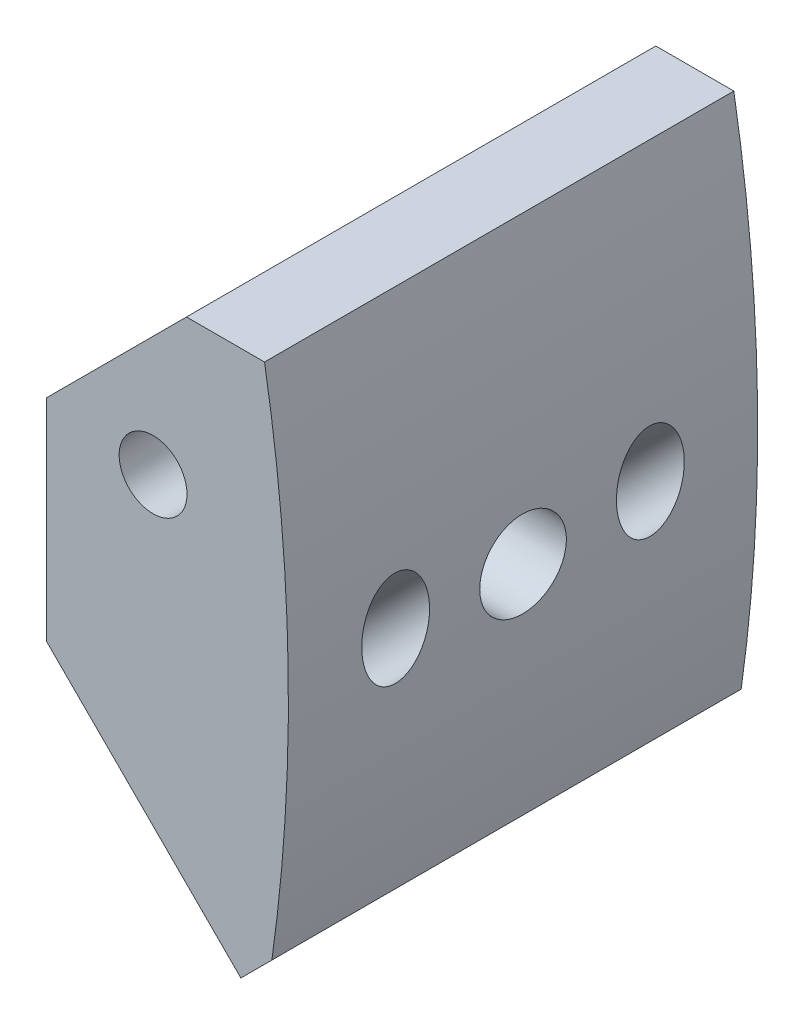
from build123d import *

# Parameters (mm, degrees)
EXTRUDE1_DEPTH            = 18.7198
SKETCH13_W                = 30.336118919
SKETCH13_H                = 26.43936277
EXTRUDE2_DEPTH            = 40.057833358
F_6_32_TAPPED_HOLE2_D     = 2.7051
EXTRUDE3_DEPTH            = 40.057833358
F_6_32_TAPPED_HOLE1_D     = 2.7051
F_8_32_TAPPED_HOLE5_D     = 3.4544
F_8_32_TAPPED_HOLE5_DEPTH = 19.05
F_8_32_TAPPED_HOLE5_TIP   = 1.037806461
SKETCH22_W                = 9.398
SKETCH22_H                = 21.690053411
EXTRUDE4_DEPTH            = 33.232321948
CHAMFER1_SIZE             = 5.588
CUT_EXTRUDE1_DEPTH        = 33.232321948


with BuildPart() as part:
    # Sketch1 → Extrude1 (new body)
    with BuildSketch(Plane.XY):
        with BuildLine():
            Line((0, 0), (0, -13.17458008))
            Line((0, -13.17458008), (15.324208221, -28.498788301))
            ThreePointArc((15.324208221, -28.498788301), (19.05, -6.58729004), (15.324208221, 15.324208221))
            Line((15.324208221, 15.324208221), (0, 15.324208221))
            Line((0, 15.324208221), (0, 0))
        make_face()
    extrude(amount=EXTRUDE1_DEPTH)

    # Sketch13 → Extrude2 (cut, through all)
    with BuildSketch(Plane.XY.offset(18.7198)):
        with Locations((15.16805946, 17.825101305)):
            Rectangle(SKETCH13_W, SKETCH13_H)
    extrude(amount=-EXTRUDE2_DEPTH, mode=Mode.SUBTRACT)

    # #6-32 Tapped Hole2 (through all)
    with Locations(Plane.XY.offset(18.7198)):
        with Locations((13.6525, -1.50729004)):
            Hole(F_6_32_TAPPED_HOLE2_D / 2)

    # Sketch14 → Extrude3 (cut, through all)
    with BuildSketch(Plane.XY.offset(18.7198)):
        Polygon((0.684709755, -13.859289835), (7.276217748, -7.267781842), (18.052525094, -18.044089188), (21.915716214, -21.907280308), (15.324208221, -28.498788301), align=None)
    extrude(amount=-EXTRUDE3_DEPTH, mode=Mode.SUBTRACT)

    # #6-32 Tapped Hole1 (through all)
    with Locations(Plane(origin=(12.651735758, -12.643299852, 14.4399), x_dir=(-0.707106781187, 0.707106781187, 0), z_dir=(-0.707106781187, -0.707106781187, 0))):
        with Locations((0, 0), (0, 10.16)):
            Hole(F_6_32_TAPPED_HOLE1_D / 2)

    # #8-32 Tapped Hole5
    with Locations(Plane.ZY):
        with Locations((9.3599, -6.58729004)):
            Hole(F_8_32_TAPPED_HOLE5_D / 2, depth=F_8_32_TAPPED_HOLE5_DEPTH)
            with Locations((0, 0, -(F_8_32_TAPPED_HOLE5_DEPTH + F_8_32_TAPPED_HOLE5_TIP / 2))):  # 118° drill point
                Cone(0, F_8_32_TAPPED_HOLE5_D / 2, F_8_32_TAPPED_HOLE5_TIP, mode=Mode.SUBTRACT)

    # Sketch22 → Extrude4 (cut, through all)
    with BuildSketch(Plane.XY.offset(18.7198)):
        with Locations((4.699, -6.239606786)):
            Rectangle(SKETCH22_W, SKETCH22_H)
    extrude(amount=-EXTRUDE4_DEPTH, mode=Mode.SUBTRACT)

    # Chamfer1
    chamfer1_edges = [part.edges().sort_by_distance(p)[0] for p in [
        (9.398, 4.60541992, 9.3599),
    ]]
    chamfer(chamfer1_edges, length=CHAMFER1_SIZE)

    # Sketch27 → Cut-Extrude1 (cut, through all)
    with BuildSketch(Plane.XY.offset(18.7198)):
        Polygon((17.154499481, -17.146063576), (21.888027801, -12.412535256), (22.786053413, -13.310560868), (18.052525094, -18.044089188), align=None)
    extrude(amount=-CUT_EXTRUDE1_DEPTH, mode=Mode.SUBTRACT)


solid = part.part
